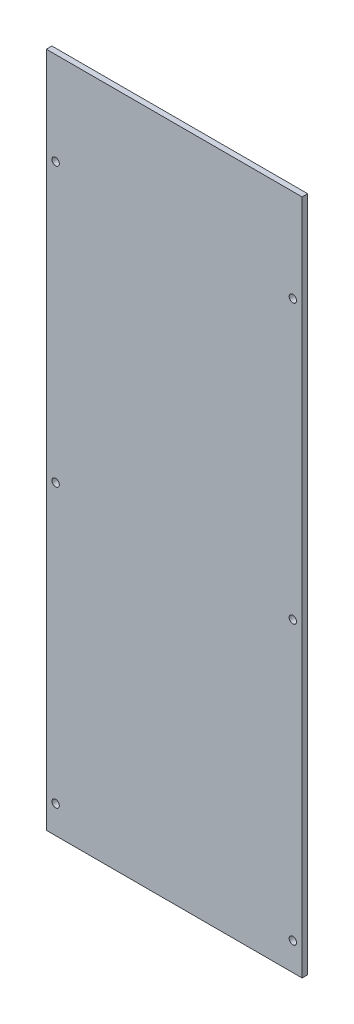
from build123d import *

# Parameters (mm, degrees)
SKETCH1_W           = 138
SKETCH1_H           = 365
SKETCH1_R           = 2
BOSS_EXTRUDE1_DEPTH = 3


with BuildPart() as part:
    # Sketch1 → Boss-Extrude1 (new body)
    with BuildSketch(Plane.XY):
        with Locations((69, -182.5)):
            Rectangle(SKETCH1_W, SKETCH1_H)
        with Locations((133, -350)):
            Circle(SKETCH1_R, mode=Mode.SUBTRACT)
        with Locations((5, -350)):
            Circle(SKETCH1_R, mode=Mode.SUBTRACT)
        with Locations((133, -200)):
            Circle(SKETCH1_R, mode=Mode.SUBTRACT)
        with Locations((5, -200)):
            Circle(SKETCH1_R, mode=Mode.SUBTRACT)
        with Locations((133, -50)):
            Circle(SKETCH1_R, mode=Mode.SUBTRACT)
        with Locations((5, -50)):
            Circle(SKETCH1_R, mode=Mode.SUBTRACT)
    extrude(amount=BOSS_EXTRUDE1_DEPTH)


solid = part.part
